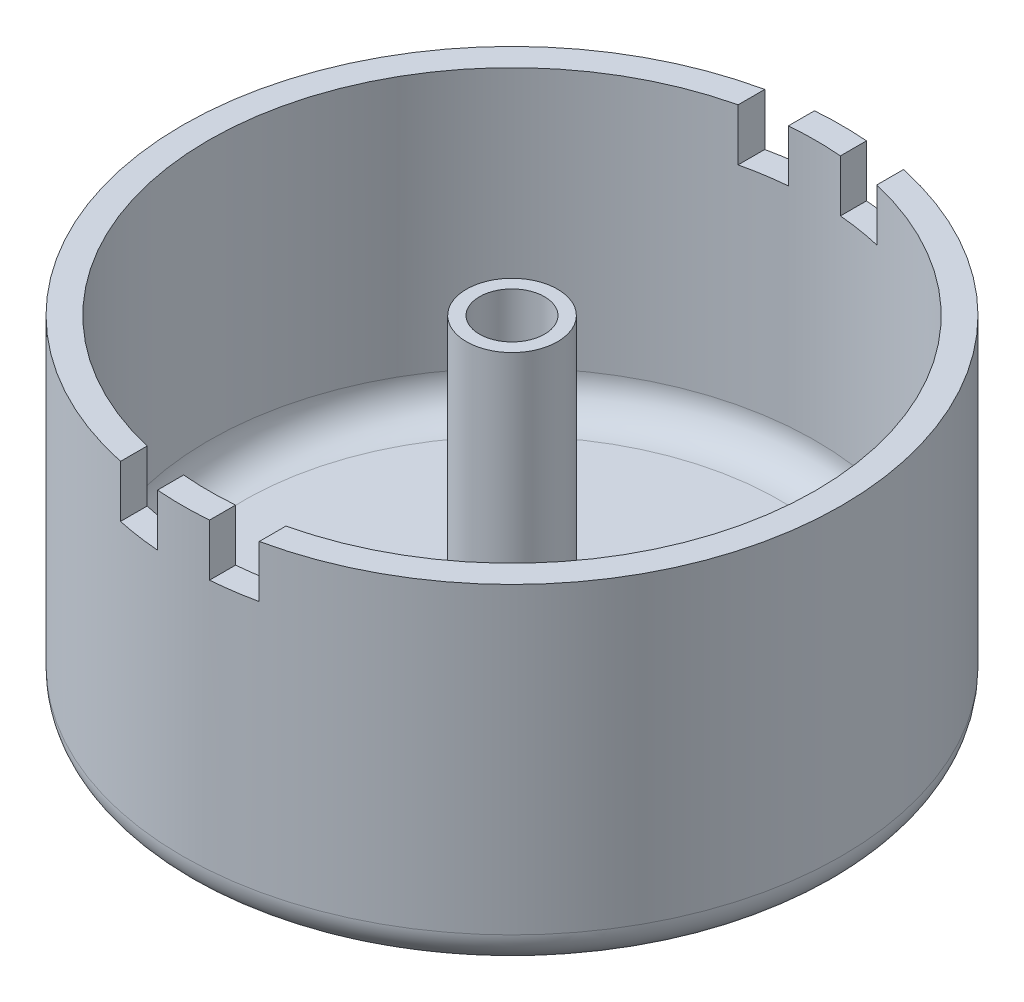
from build123d import *

# Parameters (mm, degrees)
SKETCH1_R           = 19
BOSS_EXTRUDE1_DEPTH = 2.5
BOSS_EXTRUDE2_START = 2.5
SKETCH1_3_R         = 19
SKETCH1_3_R_2       = 17.5
BOSS_EXTRUDE2_DEPTH = 17
BOSS_EXTRUDE3_START = 2.5
SKETCH1_5_R         = 2.625
SKETCH1_5_R_2       = 1.875
BOSS_EXTRUDE3_DEPTH = 17
SKETCH1_6_R         = 1.875
CUT_EXTRUDE3_DEPTH  = 34.200150602
FILLET1_R           = 2
FILLET2_R           = 2
SKETCH2_R           = 3.25
CUT_EXTRUDE5_DEPTH  = 2.5
CUT_EXTRUDE6_START  = -3
CUT_EXTRUDE6_DEPTH  = 3


with BuildPart() as part:
    # Sketch1 → Boss-Extrude1 (new body)
    with BuildSketch(Plane(origin=(0, 0, 0), x_dir=(1, 0, 0), z_dir=(0, 1, 0))):
        with Locations(Location((0, 0, 0), (0, 0, 270))):
            Circle(SKETCH1_R)
    extrude(amount=BOSS_EXTRUDE1_DEPTH)

    # Sketch1<3> → Boss-Extrude2 (add)
    with BuildSketch(Plane(origin=(0, 0, 0), x_dir=(1, 0, 0), z_dir=(0, 1, 0)).offset(BOSS_EXTRUDE2_START)):
        with Locations(Location((0, 0, 0), (0, 0, 270))):
            Circle(SKETCH1_3_R)
        with Locations(Location((0, 0, 0), (0, 0, 270))):
            Circle(SKETCH1_3_R_2, mode=Mode.SUBTRACT)
    extrude(amount=BOSS_EXTRUDE2_DEPTH)

    # Sketch1<5> → Boss-Extrude3 (add)
    with BuildSketch(Plane(origin=(0, 0, 0), x_dir=(1, 0, 0), z_dir=(0, 1, 0)).offset(BOSS_EXTRUDE3_START)):
        with Locations(Location((0, 0, 0), (0, 0, 270))):
            Circle(SKETCH1_5_R)
        with Locations(Location((0, 0, 0), (0, 0, 270))):
            Circle(SKETCH1_5_R_2, mode=Mode.SUBTRACT)
    extrude(amount=BOSS_EXTRUDE3_DEPTH)

    # Sketch1<6> → Cut-Extrude3 (cut, through all)
    with BuildSketch(Plane(origin=(0, 0, 0), x_dir=(1, 0, 0), z_dir=(0, 1, 0))):
        with Locations(Location((0, 0, 0), (0, 0, 270))):
            Circle(SKETCH1_6_R)
    extrude(amount=CUT_EXTRUDE3_DEPTH, mode=Mode.SUBTRACT)

    # Fillet1
    fillet1_edges = [part.edges().sort_by_distance(p)[0] for p in [
        (0, 0, -19),
    ]]
    fillet(fillet1_edges, radius=FILLET1_R)

    # Fillet2
    fillet2_edges = [part.edges().sort_by_distance(p)[0] for p in [
        (0, 2.5, -2.625),
        (0, 2.5, -17.5),
    ]]
    fillet(fillet2_edges, radius=FILLET2_R)

    # Sketch2 → Cut-Extrude5 (cut)
    with BuildSketch(Plane.XZ):
        with Locations(Location((0, 0, 0), (0, 0, 270))):
            Circle(SKETCH2_R)
    extrude(amount=-CUT_EXTRUDE5_DEPTH, mode=Mode.SUBTRACT)

    # Sketch3 → Cut-Extrude6 (cut)
    with BuildSketch(Plane(origin=(0, 19.5, 0), x_dir=(1, 0, 0), z_dir=(0, 1, 0)).offset(CUT_EXTRUDE6_START)):
        with BuildLine():
            Line((-4, 17.036725037), (-4, 22.5))
            Line((-4, 22.5), (-1.5, 22.5))
            Line((-1.5, 22.5), (-1.5, 17.435595774))
            ThreePointArc((-1.5, 17.435595774), (-2.757222237, 17.281427185), (-4, 17.036725037))
        make_face()
        with BuildLine():
            Line((4, 22.5), (4, 17.036725037))
            ThreePointArc((4, 17.036725037), (2.757222237, 17.281427185), (1.5, 17.435595774))
            Line((1.5, 17.435595774), (1.5, 22.5))
            Line((1.5, 22.5), (4, 22.5))
        make_face()
    cut_extrude6 = extrude(amount=CUT_EXTRUDE6_DEPTH, mode=Mode.SUBTRACT)

    # Mirror1: Cut-Extrude6 across plane
    add(cut_extrude6.mirror(Plane.XY), mode=Mode.SUBTRACT)


solid = part.part
